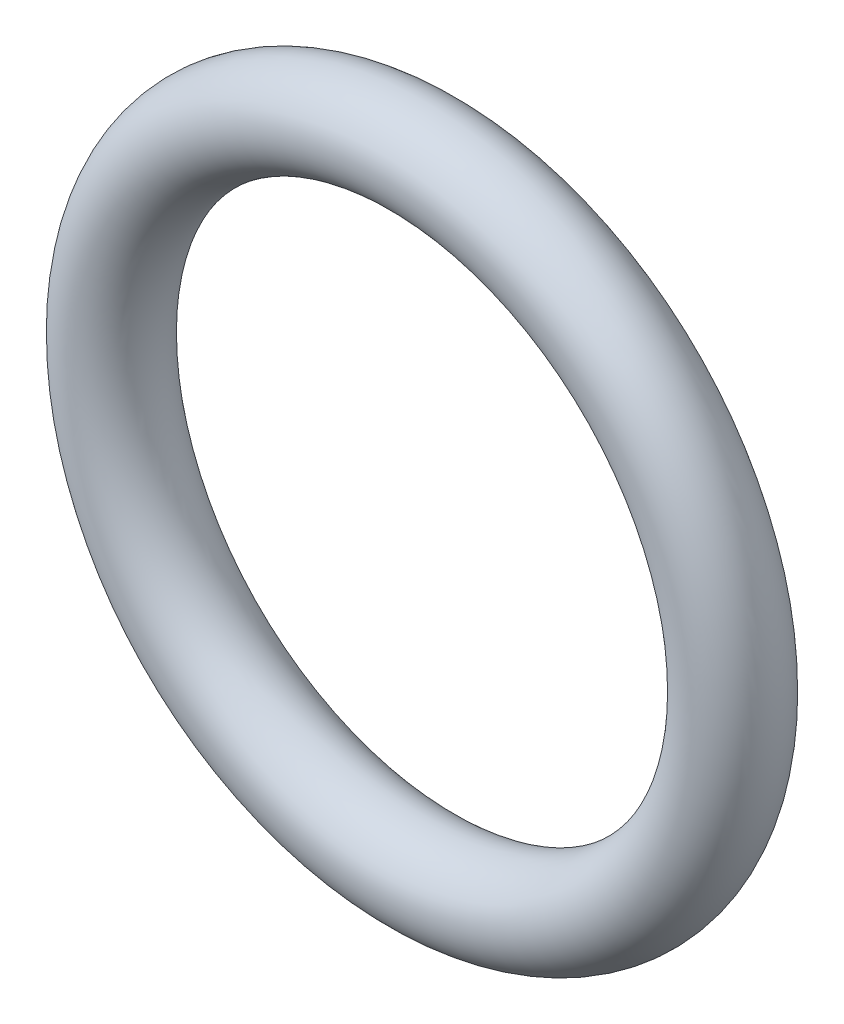
from build123d import *

# Parameters (mm, degrees)
SKETCH4_R = 2


with BuildPart() as part:
    # Sweep1: sweep along a path in Sketch3
    with BuildLine(Plane.XY) as sweep1_path:
        CenterArc((0, 0), 13.5, 0, 360)
    # Sketch4 → Sweep1 (sweep)
    with BuildSketch(Plane(origin=(0, 0, 0), x_dir=(1, 0, 0), z_dir=(0, 1, 0))):
        with Locations((-13.5, 0)):
            Circle(SKETCH4_R)
    sweep(path=sweep1_path.line)


solid = part.part
